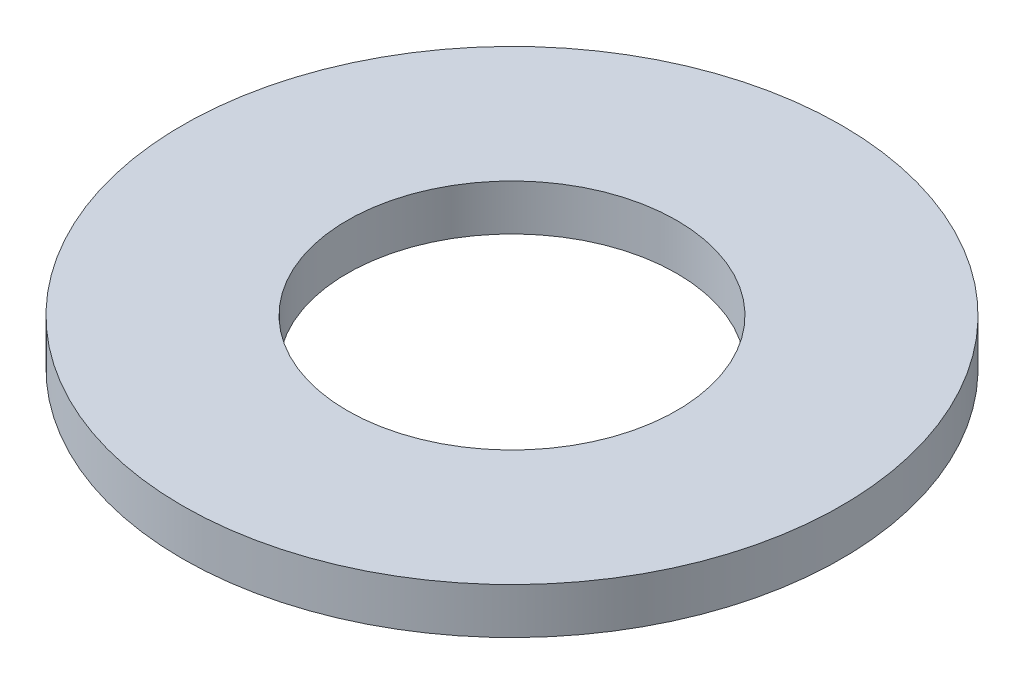
from build123d import *

# Parameters (mm, degrees)
SKETCH1_R           = 13.49375
SKETCH1_R_2         = 6.746875
BOSS_EXTRUDE1_DEPTH = 1.8796


with BuildPart() as part:
    # Sketch1 → Boss-Extrude1 (new body)
    with BuildSketch(Plane(origin=(0, 0, 0), x_dir=(1, 0, 0), z_dir=(0, 1, 0))):
        with Locations(Location((0, 0, 0), (0, 0, 270))):
            Circle(SKETCH1_R)
        with Locations(Location((0, 0, 0), (0, 0, 270))):
            Circle(SKETCH1_R_2, mode=Mode.SUBTRACT)
    extrude(amount=BOSS_EXTRUDE1_DEPTH)


solid = part.part
